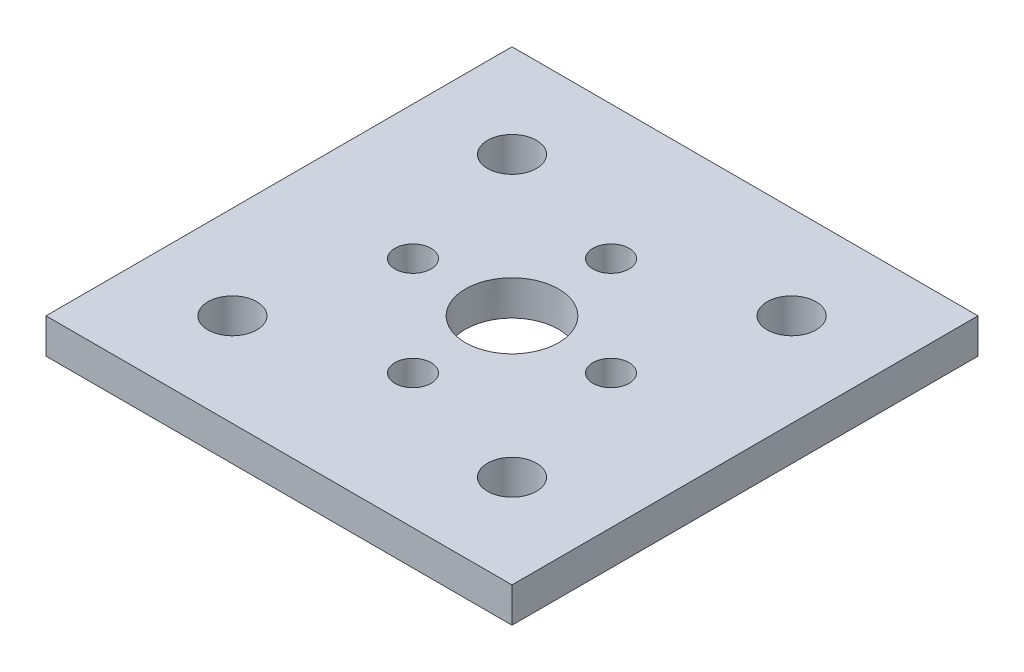
from build123d import *

# Parameters (mm, degrees)
SKETCH_1_W                = 40
SKETCH_1_H                = 40
SKETCH_1_R                = 1.55
EXTRUDE_2_DEPTH           = 3
SKETCH_1_6_R              = 4
CUT_EXTRUDE_1_DEPTH       = 1.5
SKETCH_2_W                = 3
SKETCH_2_H                = 3
EXTRUDE_7_DEPTH           = 45
SKETCH_5_W                = 40
SKETCH_5_H                = 3
EXTRUDE_8_DEPTH           = 40
CUT_EXTRUDE_2_DEPTH       = 4
CUT_EXTRUDE_START         = -4
SKETCH_7_R                = 4
CUT_EXTRUDE_3_DEPTH       = 4
SKETCH_8_R                = 5
CUT_EXTRUDE_4_DEPTH       = 4
SKETCH_9_R                = 2.5
CUT_EXTRUDE_5_DEPTH       = 4
SKETCH_10_W               = 1.5
SKETCH_10_H               = 34
SKETCH_10_W_2             = 34
SKETCH_10_H_2             = 1.5
EXTRUDE_10_DEPTH          = 45
CUT_EXTRUDE_12_DEPTH      = 63.507999488
CUT_EXTRUDE_12_DEPTH_BACK = 4
CUT_EXTRUDE_13_DEPTH      = 4
CUT_EXTRUDE_13_DEPTH_BACK = 64.442887702
CUT_EXTRUDE_15_DEPTH      = 10
CUT_EXTRUDE_15_DEPTH_BACK = 64.442887702
SKETCH_24_5_R             = 1.85
SKETCH_24_5_R_2           = 5.5
CUT_EXTRUDE_16_DEPTH      = 10
CUT_EXTRUDE_16_DEPTH_BACK = 64.442887702
SKETCH_25_R               = 5.5
SKETCH_25_R_2             = 1.85
SKETCH_26_W               = 40
SKETCH_26_H               = 40
CUT_EXTRUDE_17_DEPTH      = 54.150729064
EXTRUDE_START             = -3
SKETCH_27_R               = 5
SKETCH_27_R_2             = 2.1
EXTRUDE_12_DEPTH          = 3


with BuildPart() as part:
    # 草图1 → 凸台-拉伸2 (new body)
    with BuildSketch(Plane(origin=(0, 0, 0), x_dir=(1, 0, 0), z_dir=(0, 1, 0))):
        Rectangle(SKETCH_1_W, SKETCH_1_H)
        with Locations((0, 8.5)):
            Circle(SKETCH_1_R, mode=Mode.SUBTRACT)
        with Locations((8.5, 0)):
            Circle(SKETCH_1_R, mode=Mode.SUBTRACT)
        with Locations((0, -8.5)):
            Circle(SKETCH_1_R, mode=Mode.SUBTRACT)
        with Locations((-8.5, 0)):
            Circle(SKETCH_1_R, mode=Mode.SUBTRACT)
    extrude(amount=-EXTRUDE_2_DEPTH)

    # 草图1<6> → 切除-拉伸1 (cut)
    with BuildSketch(Plane(origin=(0, 0, 0), x_dir=(1, 0, 0), z_dir=(0, 1, 0))):
        Circle(SKETCH_1_6_R)
    extrude(amount=-CUT_EXTRUDE_1_DEPTH, mode=Mode.SUBTRACT)

    # 草图2 → 凸台-拉伸7 (add)
    with BuildSketch(Plane(origin=(0, 0, 0), x_dir=(1, 0, 0), z_dir=(0, 1, 0))):
        with Locations((-18.5, -18.5)):
            Rectangle(SKETCH_2_W, SKETCH_2_H)
        with Locations((18.5, -18.5)):
            Rectangle(SKETCH_2_W, SKETCH_2_H)
        with Locations((-18.5, 18.5)):
            Rectangle(SKETCH_2_W, SKETCH_2_H)
        with Locations((18.5, 18.5)):
            Rectangle(SKETCH_2_W, SKETCH_2_H)
    extrude(amount=EXTRUDE_7_DEPTH)

    # 草图5 → 凸台-拉伸8 (add)
    with BuildSketch(Plane.ZY.offset(20)):
        with Locations((0, 43.5)):
            Rectangle(SKETCH_5_W, SKETCH_5_H)
    extrude(amount=-EXTRUDE_8_DEPTH)

    # 草图6 → 切除-拉伸2 (cut)
    with BuildSketch(Plane(origin=(0, 45, 0), x_dir=(1, 0, 0), z_dir=(0, 1, 0))):
        with BuildLine():
            ThreePointArc((12.5, 0), (-8.838834765, 8.838834765), (0, -12.5))
            ThreePointArc((0, -12.5), (8.838834765, -8.838834765), (12.5, 0))
        make_face()
    extrude(amount=-CUT_EXTRUDE_2_DEPTH, mode=Mode.SUBTRACT)

    # 草图7 → 切除-拉伸3 (cut)
    with BuildSketch(Plane.XZ.offset(3).offset(CUT_EXTRUDE_START)):
        Circle(SKETCH_7_R)
    extrude(amount=CUT_EXTRUDE_3_DEPTH, mode=Mode.SUBTRACT)

    # 草图8 → 切除-拉伸4 (cut)
    with BuildSketch(Plane.XZ.offset(3)):
        with Locations((-12, 12)):
            Circle(SKETCH_8_R)
        with Locations((12, 12)):
            Circle(SKETCH_8_R)
        with Locations((12, -12)):
            Circle(SKETCH_8_R)
        with Locations((-12, -12)):
            Circle(SKETCH_8_R)
    extrude(amount=-CUT_EXTRUDE_4_DEPTH, mode=Mode.SUBTRACT)

    # 草图9 → 切除-拉伸5 (cut)
    with BuildSketch(Plane(origin=(0, 45, 0), x_dir=(1, 0, 0), z_dir=(0, 1, 0))):
        with Locations((-12.727922061, 12.727922061)):
            Circle(SKETCH_9_R)
        with Locations((12.727922061, 12.727922061)):
            Circle(SKETCH_9_R)
        with Locations((12.727922061, -12.727922061)):
            Circle(SKETCH_9_R)
        with Locations((-12.727922061, -12.727922061)):
            Circle(SKETCH_9_R)
    extrude(amount=-CUT_EXTRUDE_5_DEPTH, mode=Mode.SUBTRACT)

    # 草图10 → 凸台-拉伸10 (add)
    with BuildSketch(Plane(origin=(0, 0, 0), x_dir=(1, 0, 0), z_dir=(0, 1, 0))):
        with Locations((19.25, 0)):
            Rectangle(SKETCH_10_W, SKETCH_10_H)
        with Locations((0, -19.25)):
            Rectangle(SKETCH_10_W_2, SKETCH_10_H_2)
        with Locations((-19.25, 0)):
            Rectangle(SKETCH_10_W, SKETCH_10_H)
        with Locations((0, 19.25)):
            Rectangle(SKETCH_10_W_2, SKETCH_10_H_2)
    extrude(amount=EXTRUDE_10_DEPTH)

    # 草图20 → 切除-拉伸12 (cut, two sides: drawn at the far end of the back side and taken through both)
    with BuildSketch(Plane(origin=(0, 0, 18.5), x_dir=(-1, 0, 0), z_dir=(0, 0, -1)).offset(-CUT_EXTRUDE_12_DEPTH_BACK)):
        with BuildLine():
            Line((-2.45, 36.5), (-2.45, 5.5))
            ThreePointArc((-2.45, 5.5), (0, 3.05), (2.45, 5.5))
            Line((2.45, 5.5), (2.45, 36.5))
            ThreePointArc((2.45, 36.5), (0, 38.95), (-2.45, 36.5))
        make_face()
    extrude(amount=CUT_EXTRUDE_12_DEPTH + CUT_EXTRUDE_12_DEPTH_BACK, mode=Mode.SUBTRACT)

    # 草图24 → 切除-拉伸13 (cut, two sides: drawn at the far end of the back side and taken through both)
    with BuildSketch(Plane(origin=(20, 0, 0), x_dir=(0, 0, -1), z_dir=(1, 0, 0)).offset(-CUT_EXTRUDE_13_DEPTH_BACK)):
        with BuildLine():
            Line((-2.45, 36.5), (-2.45, 5.5))
            ThreePointArc((-2.45, 5.5), (0, 3.05), (2.45, 5.5))
            Line((2.45, 5.5), (2.45, 36.5))
            ThreePointArc((2.45, 36.5), (0, 38.95), (-2.45, 36.5))
        make_face()
    extrude(amount=CUT_EXTRUDE_13_DEPTH + CUT_EXTRUDE_13_DEPTH_BACK, mode=Mode.SUBTRACT)

    # 草图24<5> → 切除-拉伸15 (cut, two sides: drawn at the far end of the back side and taken through both)
    with BuildSketch(Plane(origin=(20, 0, 0), x_dir=(0, 0, -1), z_dir=(1, 0, 0)).offset(-CUT_EXTRUDE_15_DEPTH_BACK)):
        with Locations((-11.45, 35)):
            Circle(SKETCH_24_5_R)
        with Locations((-11.45, 7)):
            Circle(SKETCH_24_5_R)
        with Locations((11.45, 7)):
            Circle(SKETCH_24_5_R)
        with Locations((11.45, 35)):
            Circle(SKETCH_24_5_R)
        with Locations((-11.35, 21)):
            Circle(SKETCH_24_5_R_2)
        with Locations((11.35, 21)):
            Circle(SKETCH_24_5_R_2)
    extrude(amount=CUT_EXTRUDE_15_DEPTH + CUT_EXTRUDE_15_DEPTH_BACK, mode=Mode.SUBTRACT)

    # 草图25 → 切除-拉伸16 (cut, two sides: drawn at the far end of the back side and taken through both)
    with BuildSketch(Plane(origin=(0, 0, -20), x_dir=(-1, 0, 0), z_dir=(0, 0, -1)).offset(-CUT_EXTRUDE_16_DEPTH_BACK)):
        with Locations((-11.45, 21)):
            Circle(SKETCH_25_R)
        with Locations((-11.45, 35)):
            Circle(SKETCH_25_R_2)
        with Locations((11.45, 35)):
            Circle(SKETCH_25_R_2)
        with Locations((11.45, 7)):
            Circle(SKETCH_25_R_2)
        with Locations((-11.45, 7)):
            Circle(SKETCH_25_R_2)
        with Locations((11.45, 21)):
            Circle(SKETCH_25_R)
    extrude(amount=CUT_EXTRUDE_16_DEPTH + CUT_EXTRUDE_16_DEPTH_BACK, mode=Mode.SUBTRACT)

    # 草图26 → 切除-拉伸17 (cut, through all)
    with BuildSketch(Plane(origin=(0, 0, 0), x_dir=(1, 0, 0), z_dir=(0, 1, 0))):
        Rectangle(SKETCH_26_W, SKETCH_26_H)
    extrude(amount=CUT_EXTRUDE_17_DEPTH, mode=Mode.SUBTRACT)

    # 草图27 → 凸台-拉伸12 (add)
    # profile 1 of 4: a face of its own
    with BuildSketch(Plane(origin=(0, 0, 0), x_dir=(1, 0, 0), z_dir=(0, 1, 0)).offset(EXTRUDE_START)):
        with Locations((-12, 12)):
            Circle(SKETCH_27_R)
        with Locations((-12, 12)):
            Circle(SKETCH_27_R_2, mode=Mode.SUBTRACT)
    # profile 2 of 4: a face of its own
    with BuildSketch(Plane(origin=(0, 0, 0), x_dir=(1, 0, 0), z_dir=(0, 1, 0)).offset(EXTRUDE_START)):
        with Locations((12, 12)):
            Circle(SKETCH_27_R)
        with Locations((12, 12)):
            Circle(SKETCH_27_R_2, mode=Mode.SUBTRACT)
    # profile 3 of 4: a face of its own
    with BuildSketch(Plane(origin=(0, 0, 0), x_dir=(1, 0, 0), z_dir=(0, 1, 0)).offset(EXTRUDE_START)):
        with Locations((-12, -12)):
            Circle(SKETCH_27_R)
        with Locations((-12, -12)):
            Circle(SKETCH_27_R_2, mode=Mode.SUBTRACT)
    # profile 4 of 4: a face of its own
    with BuildSketch(Plane(origin=(0, 0, 0), x_dir=(1, 0, 0), z_dir=(0, 1, 0)).offset(EXTRUDE_START)):
        with Locations((12, -12)):
            Circle(SKETCH_27_R)
        with Locations((12, -12)):
            Circle(SKETCH_27_R_2, mode=Mode.SUBTRACT)
    extrude(amount=EXTRUDE_12_DEPTH)


solid = part.part
